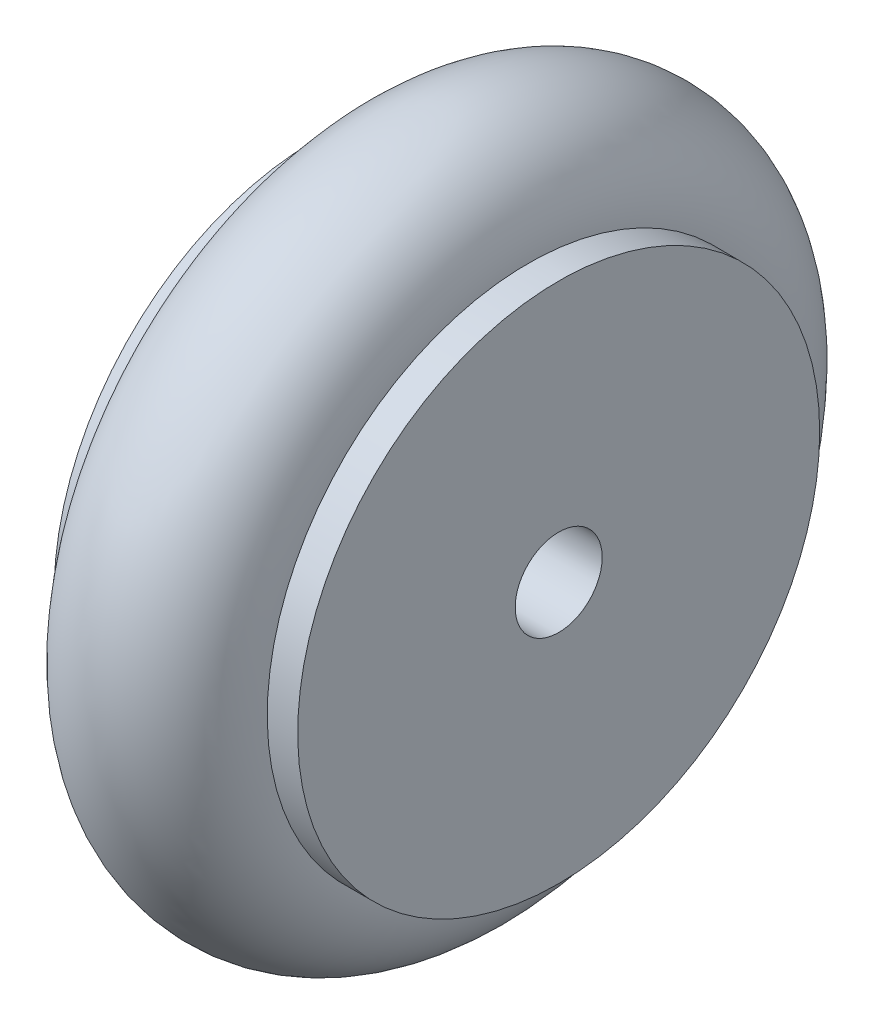
from build123d import *

# Parameters (mm, degrees)
SKETCH1_R           = 3
BOSS_EXTRUDE1_DEPTH = 2.8
SKETCH4_R           = 1.05
SKETCH5_R           = 0.5
CUT_EXTRUDE1_DEPTH  = 2.8


with BuildPart() as part:
    # Sketch1 → Boss-Extrude1 (new body)
    with BuildSketch(Plane(origin=(0, 0, 0), x_dir=(0, 0, -1), z_dir=(1, 0, 0))):
        Circle(SKETCH1_R)
    extrude(amount=BOSS_EXTRUDE1_DEPTH)

    # Sketch4 → Revolve1 (revolve)
    with BuildSketch(Plane.XY, mode=Mode.PRIVATE) as revolve1_sk:
        with Locations((1.4, 3)):
            Circle(SKETCH4_R)
    revolve(revolve1_sk.sketch.rotate(Axis((0, 0, 0), (1, 0, 0)), 180), axis=Axis((0, 0, 0), (1, 0, 0)))

    # Sketch5 → Cut-Extrude1 (cut)
    with BuildSketch(Plane(origin=(2.8, 0, 0), x_dir=(0, 0, -1), z_dir=(1, 0, 0))):
        Circle(SKETCH5_R)
    extrude(amount=-CUT_EXTRUDE1_DEPTH, mode=Mode.SUBTRACT)


solid = part.part
